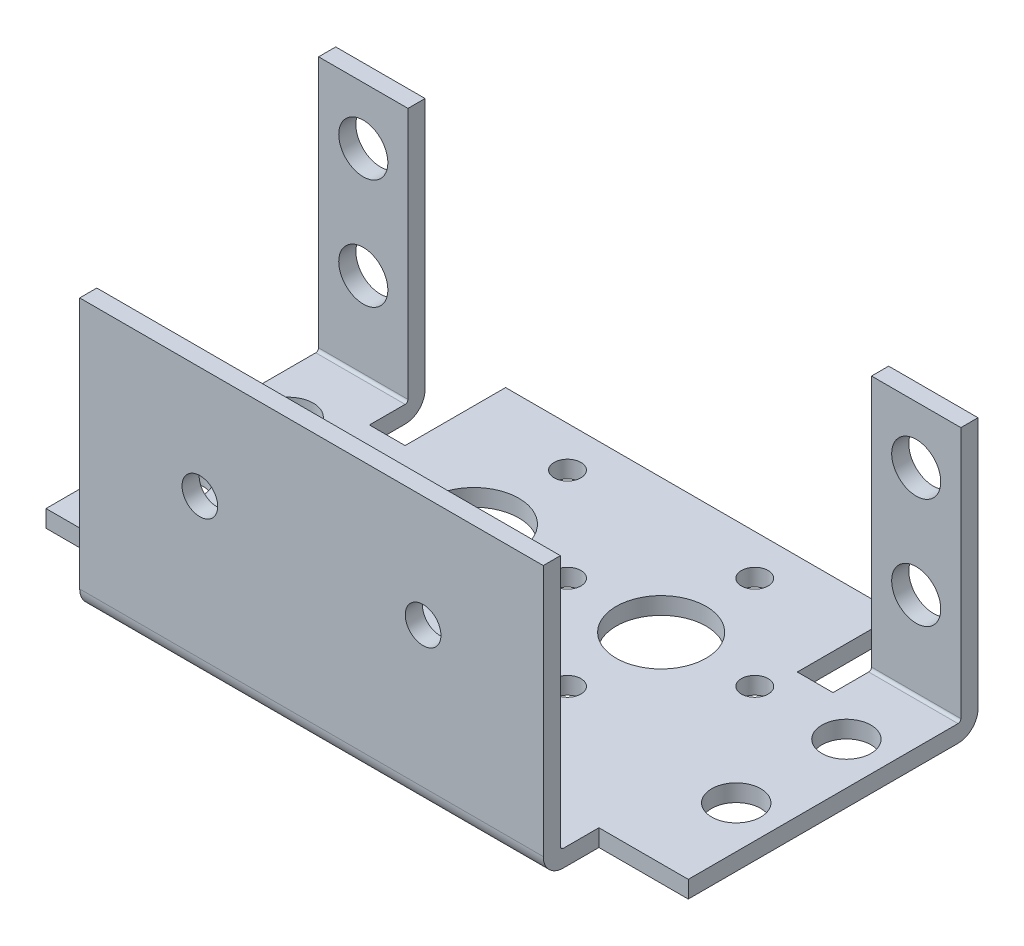
from build123d import *

# Parameters (mm, degrees)
SKETCH1_R      = 2.1844
SKETCH1_R_2    = 1.1938
SKETCH1_R_3    = 4.0005
EXTRUDE1_DEPTH = 1.524
EXTRUDE3_START = -13.3731
SKETCH3_W      = 7.9502
SKETCH3_H      = 24.2062
SKETCH3_R      = 2.1844
EXTRUDE3_DEPTH = 1.524
EXTRUDE4_START = 15.8369
SKETCH3_3_W    = 41.2496
SKETCH3_3_H    = 24.2062
SKETCH3_3_R    = 1.5875
EXTRUDE4_DEPTH = 1.524
FILLET4_R      = 1.778
FILLET5_R      = 0.254


with BuildPart() as part:
    # Sketch1 → Extrude1 (new body)
    # profile 1 of 2: a face of its own
    with BuildSketch(Plane(origin=(0, 0, 0), x_dir=(1, 0, 0), z_dir=(0, 1, 0))):
        Polygon((28.575, -12.4079), (28.575, 0), (-28.575, 0), (-28.575, -12.4079), (-20.6248, -12.4079), (-20.6248, -17.3609), (20.6248, -17.3609), (20.6248, -12.4079), align=None)
        with Locations(Location((-24.8158, -4.3815, 0), (0, 0, 90))):
            Circle(SKETCH1_R, mode=Mode.SUBTRACT)
        with Locations(Location((-8.3312, -2.9083, 0), (0, 0, 90))):
            Circle(SKETCH1_R_2, mode=Mode.SUBTRACT)
        with Locations(Location((8.3312, -2.9083, 0), (0, 0, 90))):
            Circle(SKETCH1_R_2, mode=Mode.SUBTRACT)
        with Locations(Location((24.8158, -4.3815, 0), (0, 0, 90))):
            Circle(SKETCH1_R, mode=Mode.SUBTRACT)
    # profile 2 of 2: a face of its own
    with BuildSketch(Plane(origin=(0, 0, 0), x_dir=(1, 0, 0), z_dir=(0, 1, 0))):
        Polygon((-28.575, 0), (28.575, 0), (28.575, 13.3731), (20.6248, 13.3731), (20.6248, 8.4201), (17.4498, 8.4201), (17.4498, 17.3609), (-17.4498, 17.3609), (-17.4498, 8.4201), (-20.6248, 8.4201), (-20.6248, 13.3731), (-28.575, 13.3731), align=None)
        with Locations(Location((-24.8158, 5.4229, 0), (0, 0, 90))):
            Circle(SKETCH1_R, mode=Mode.SUBTRACT)
        with Locations(Location((-16.6624, 5.4229, 0), (0, 0, 90))):
            Circle(SKETCH1_R_2, mode=Mode.SUBTRACT)
        with Locations(Location((-8.3312, 5.4229, 0), (0, 0, 90))):
            Circle(SKETCH1_R_3, mode=Mode.SUBTRACT)
        with Locations(Location((-8.3312, 13.7541, 0), (0, 0, 90))):
            Circle(SKETCH1_R_2, mode=Mode.SUBTRACT)
        with Locations(Location((0, 5.4229, 0), (0, 0, 90))):
            Circle(SKETCH1_R_2, mode=Mode.SUBTRACT)
        with Locations(Location((8.3312, 5.4229, 0), (0, 0, 90))):
            Circle(SKETCH1_R_3, mode=Mode.SUBTRACT)
        with Locations(Location((16.6624, 5.4229, 0), (0, 0, 90))):
            Circle(SKETCH1_R_2, mode=Mode.SUBTRACT)
        with Locations(Location((24.8158, 5.4229, 0), (0, 0, 90))):
            Circle(SKETCH1_R, mode=Mode.SUBTRACT)
        with Locations(Location((8.3312, 13.7541, 0), (0, 0, 90))):
            Circle(SKETCH1_R_2, mode=Mode.SUBTRACT)
    extrude(amount=EXTRUDE1_DEPTH)

    # Sketch3 → Extrude3 (add)
    # profile 1 of 2: a face of its own
    with BuildSketch(Plane.XY.offset(EXTRUDE3_START)):
        with Locations((-24.5999, 12.1031)):
            Rectangle(SKETCH3_W, SKETCH3_H)
        with Locations(Location((-24.5999, 19.1262, 0), (0, 0, 180))):
            Circle(SKETCH3_R, mode=Mode.SUBTRACT)
        with Locations(Location((-24.5999, 9.3218, 0), (0, 0, 180))):
            Circle(SKETCH3_R, mode=Mode.SUBTRACT)
    # profile 2 of 2: a face of its own
    with BuildSketch(Plane.XY.offset(EXTRUDE3_START)):
        with Locations((24.5999, 12.1031)):
            Rectangle(SKETCH3_W, SKETCH3_H)
        with Locations(Location((24.5999, 9.3218, 0), (0, 0, 180))):
            Circle(SKETCH3_R, mode=Mode.SUBTRACT)
        with Locations(Location((24.5999, 19.1262, 0), (0, 0, 180))):
            Circle(SKETCH3_R, mode=Mode.SUBTRACT)
    extrude(amount=EXTRUDE3_DEPTH)

    # Sketch3<3> → Extrude4 (add)
    with BuildSketch(Plane.XY.offset(EXTRUDE4_START)):
        with Locations((0, 12.1031)):
            Rectangle(SKETCH3_3_W, SKETCH3_3_H)
        with Locations((-9.9314, 14.2748)):
            Circle(SKETCH3_3_R, mode=Mode.SUBTRACT)
        with Locations((9.9314, 14.2748)):
            Circle(SKETCH3_3_R, mode=Mode.SUBTRACT)
    extrude(amount=EXTRUDE4_DEPTH)

    # Fillet4
    fillet4_edges = [part.edges().sort_by_distance(p)[0] for p in [
        (0, 0, 17.3609),
        (-24.5999, 0, -13.3731),
        (24.5999, 0, -13.3731),
    ]]
    fillet(fillet4_edges, radius=FILLET4_R)

    # Fillet5
    fillet5_edges = [part.edges().sort_by_distance(p)[0] for p in [
        (24.5999, 1.524, -11.8491),
        (0, 1.524, 15.8369),
        (-24.5999, 1.524, -11.8491),
    ]]
    fillet(fillet5_edges, radius=FILLET5_R)


solid = part.part
